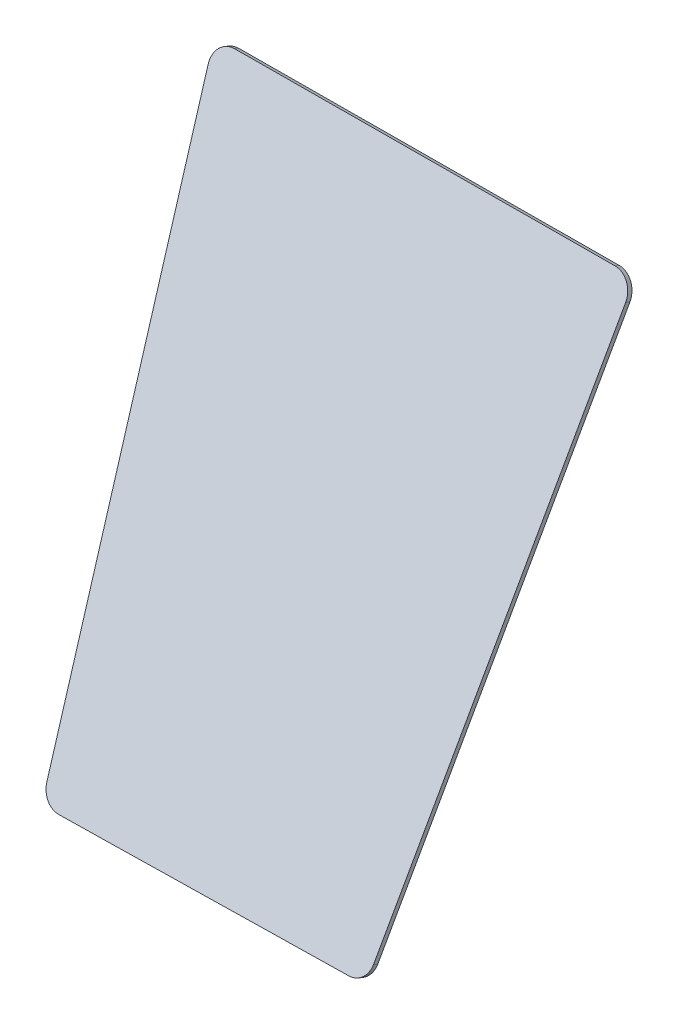
from build123d import *

# Parameters (mm, degrees)
BOSS_EXTRUDE1_DEPTH = 3.175
FILLET1_R           = 12.7


with BuildPart() as part:
    # Sketch1 → Boss-Extrude1 (new body)
    with BuildSketch(Plane(origin=(0, 407.886507076, 975.028347662), x_dir=(1, 0, 0), z_dir=(0, 0.38592481598359657, 0.922530236040005))):
        Polygon((144.331189968, 73.343707369), (-144.331189968, 72.063414553), (-110.678400742, -322.378637797), (110.678400742, -319.252822954), align=None)
    extrude(amount=-BOSS_EXTRUDE1_DEPTH)

    # Fillet1
    fillet1_edges = [part.edges().sort_by_distance(p)[0] for p in [
        (110.678400742, 112.753469314, 1096.771417863),
        (-110.678400742, 109.86981061, 1097.977747381),
        (-144.331189968, 473.754530268, 945.752770911),
        (144.331189968, 474.935639101, 945.258674142),
    ]]
    fillet(fillet1_edges, radius=FILLET1_R)


solid = part.part
